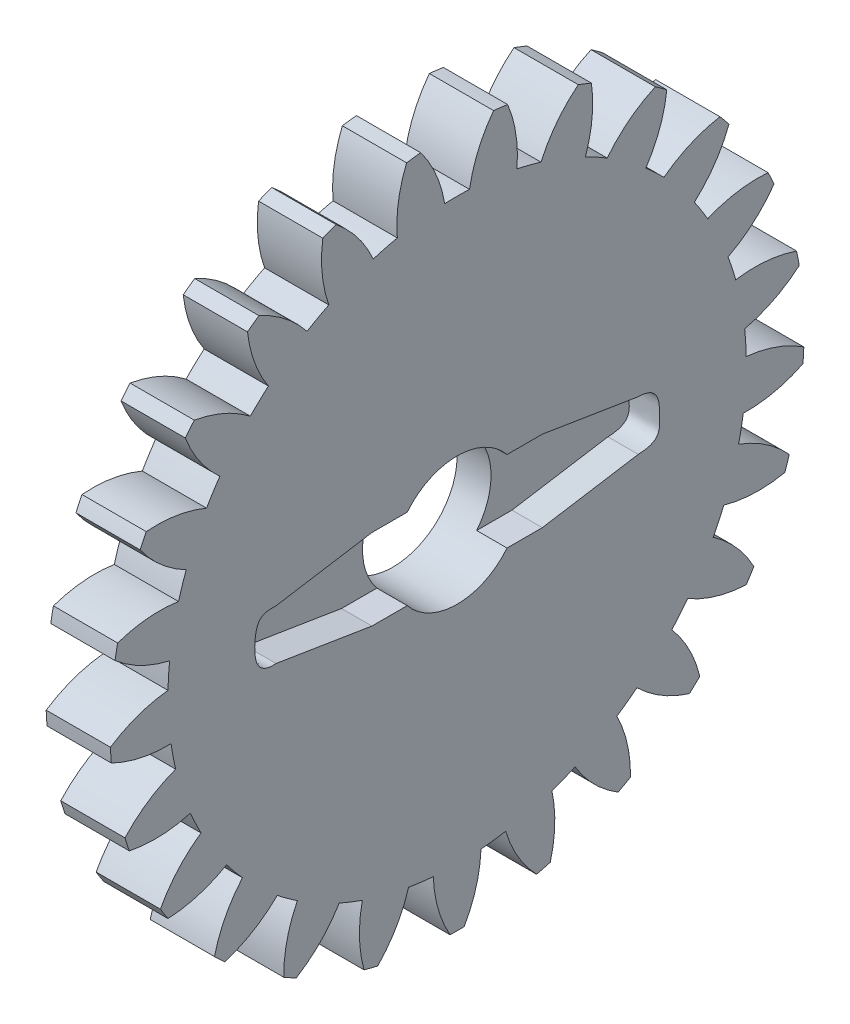
from build123d import *

# Parameters (mm, degrees)
BASPROSKE_W        = 6.35
BASPROSKE_H        = 34.29
TOOTHCUT_DEPTH     = 49.907368565
TEETHCUTS_COUNT    = 25
TEETHCUTS_ANGLE    = 345.6
BORSKE_R           = 6.35
BORE_DEPTH         = 50.8000508
CUT_EXTRUDE1_DEPTH = 3


with BuildPart() as part:
    # BasProSke → Base-Revolve (revolve)
    with BuildSketch(Plane(origin=(0, 0, 0), x_dir=(1, 0, 0), z_dir=(0, 1, 0)), mode=Mode.PRIVATE) as base_revolve_sk:
        with Locations((3.175, 17.145)):
            Rectangle(BASPROSKE_W, BASPROSKE_H)
    revolve(base_revolve_sk.sketch.rotate(Axis((-10, 0, 0), (1, 0, 0)), 180), axis=Axis((-10, 0, 0), (1, 0, 0)))

    # TooCutSke → ToothCut (cut, through all)
    with BuildSketch(Plane(origin=(0, 0, 0), x_dir=(0, 0, -1), z_dir=(1, 0, 0))):
        with BuildLine():
            ThreePointArc((1.227638411, 28.547345762), (0, 28.57373), (-1.227638411, 28.547345762))
            ThreePointArc((-1.227638411, 28.547345762), (-2.085725605, 31.480614743), (-3.619717638, 34.123955242))
            ThreePointArc((-3.619717638, 34.123955242), (0, 34.3154), (3.619717638, 34.123955242))
            ThreePointArc((3.619717638, 34.123955242), (2.085725605, 31.480614743), (1.227638411, 28.547345762))
        make_face()
    toothcut = extrude(amount=TOOTHCUT_DEPTH, mode=Mode.SUBTRACT)

    # TeethCuts: ToothCut ×25 about axis
    teethcuts_axis = Axis((-10, 0, 0), (1, 0, 0))
    for i in range(1, TEETHCUTS_COUNT):
        add(toothcut.rotate(teethcuts_axis, i * TEETHCUTS_ANGLE / (TEETHCUTS_COUNT - 1)), mode=Mode.SUBTRACT)

    # BorSke → Bore (cut, symmetric)
    with BuildSketch(Plane(origin=(0, 0, 0), x_dir=(0, 0, -1), z_dir=(1, 0, 0))):
        with Locations(Location((0, 0, 0), (0, 0, 180))):
            Circle(BORSKE_R)
    extrude(amount=BORE_DEPTH, both=True, mode=Mode.SUBTRACT)

    # Sketch1 → Cut-Extrude1 (cut)
    with BuildSketch(Plane(origin=(6.35, 0, 0), x_dir=(0, 0, -1), z_dir=(1, 0, 0))):
        with BuildLine():
            Line((17.898853189, -2.467978147), (8.419183588, -4))
            Line((8.419183588, -4), (3.919183588, -4))
            add(Edge.make_bspline(
                [(3.919183588, -4), (0, -7.2), (-3.919183588, -4)],
                knots=[0, 0, 0, 1, 1, 1], degree=2))
            Line((-3.919183588, -4), (-8.419183588, -4))
            Line((-8.419183588, -4), (-17.898853189, -2.467978147))
            add(Edge.make_bspline(
                [(-17.898853189, 2.467978147), (-19.149615056, 2.509332033), (-19.873380367, 2.372025905), (-20.078667352, -1.208741201), (-19.543433152, -2.606773936), (-17.898853189, -2.467978147)],
                knots=[0, 0, 0, 0, 0.571712182, 0.671712182, 1, 1, 1, 1], degree=3))
            Line((-17.898853189, 2.467978147), (-8.419183588, 4))
            Line((-8.419183588, 4), (-3.919183588, 4))
            add(Edge.make_bspline(
                [(3.919183588, 4), (0, 7.2), (-3.919183588, 4)],
                knots=[0, 0, 0, 1, 1, 1], degree=2))
            Line((3.919183588, 4), (8.419183588, 4))
            Line((8.419183588, 4), (17.898853189, 2.467978147))
            add(Edge.make_bspline(
                [(17.898853189, 2.467978147), (19.569523565, 2.444629682), (20.025416522, 1.325706455), (19.979573656, -1.037983093), (20.186538624, -2.400122897), (17.898853189, -2.467978147)],
                knots=[0, 0, 0, 0, 0.495063361, 0.595063361, 1, 1, 1, 1], degree=3))
        make_face()
    extrude(amount=-CUT_EXTRUDE1_DEPTH, mode=Mode.SUBTRACT)


solid = part.part
